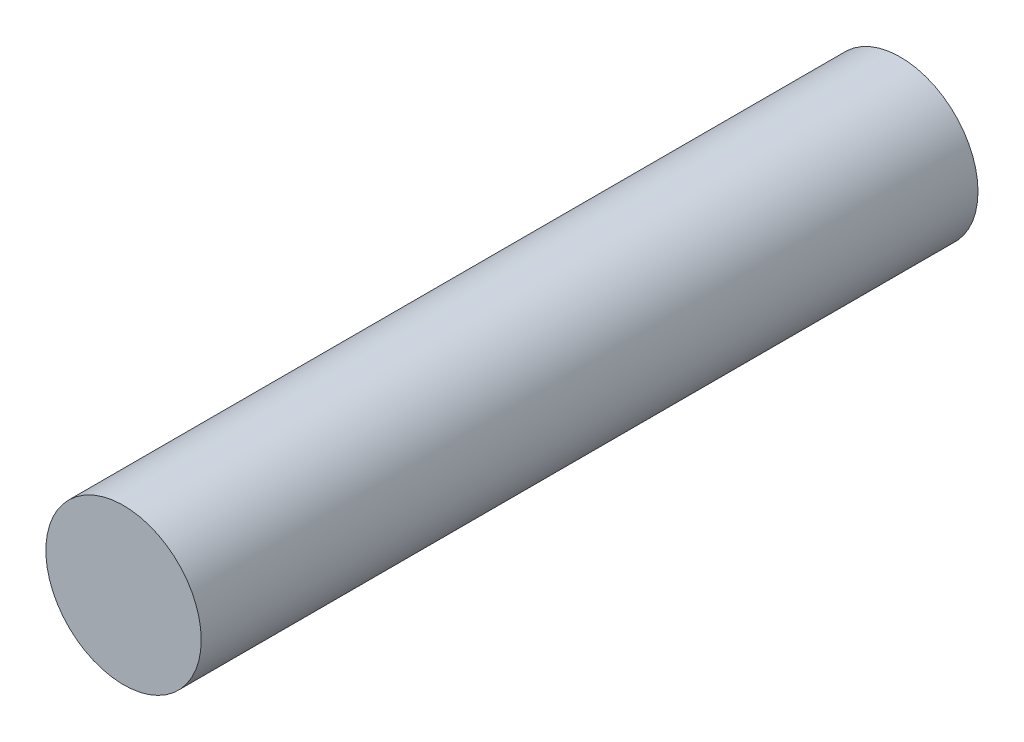
from build123d import *

# Parameters (mm, degrees)
SKETCH1_R           = 0.8
BOSS_EXTRUDE1_DEPTH = 8


with BuildPart() as part:
    # Sketch1 → Boss-Extrude1 (new body)
    with BuildSketch(Plane.XY):
        with Locations((-35.20996602, 21.87766658)):
            Circle(SKETCH1_R)
    extrude(amount=BOSS_EXTRUDE1_DEPTH)


solid = part.part
